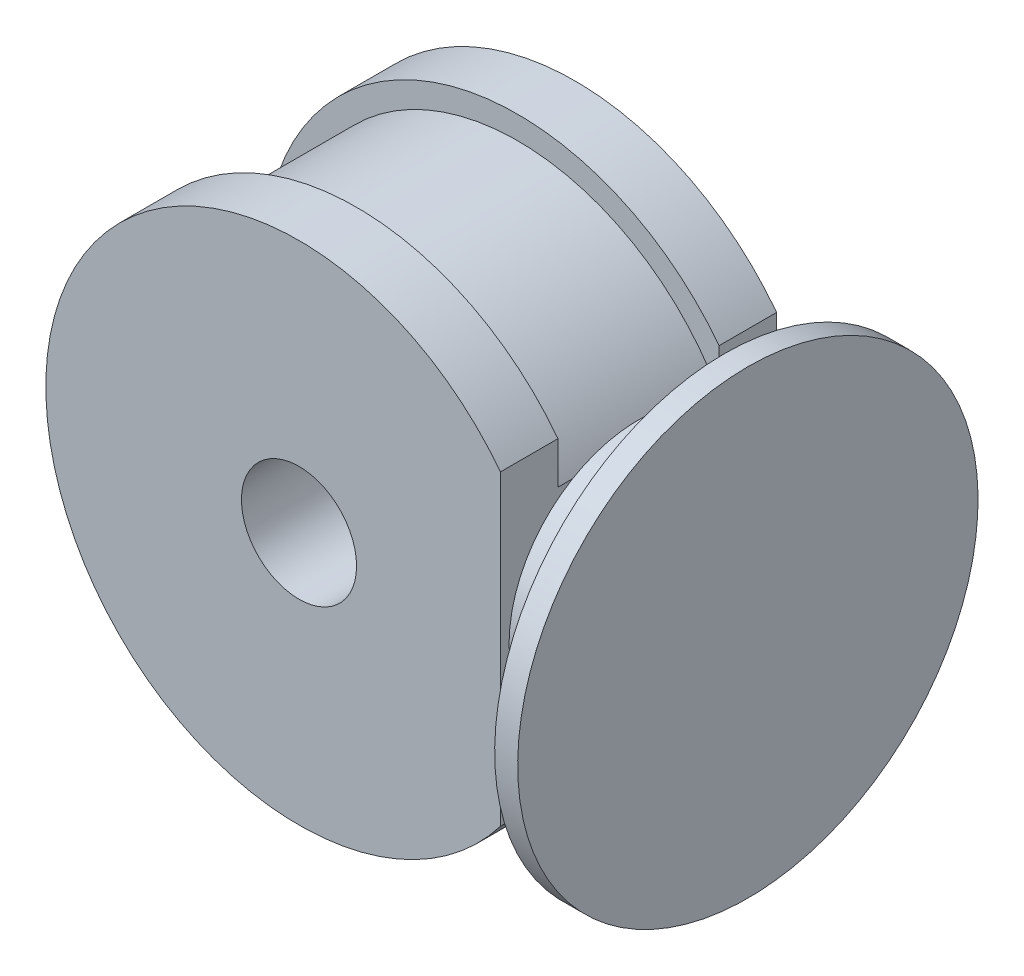
from build123d import *

# Parameters (mm, degrees)
ESQUISSE1_R             = 44
BOSS_EXTRU_1_DEPTH      = 10
ESQUISSE2_R             = 40
BOSS_EXTRU_2_DEPTH      = 28
ESQUISSE3_R             = 44
BOSS_EXTRU_3_DEPTH      = 10
ESQUISSE5_W             = 32.472445712
ESQUISSE5_H             = 94.731646138
ENL_V_MAT_EXTRU_2_DEPTH = 79.587530818
ESQUISSE4_R             = 10
ENL_V_MAT_EXTRU_1_DEPTH = 79.587530818
SKETCH1_R               = 22.5
BOSS_EXTRUDE1_DEPTH     = 15
SKETCH2_R               = 40
BOSS_EXTRUDE2_DEPTH     = 4


with BuildPart() as part:
    # Esquisse1 → Boss.-Extru.1 (new body)
    with BuildSketch(Plane.XY):
        Circle(ESQUISSE1_R)
    extrude(amount=BOSS_EXTRU_1_DEPTH)

    # Esquisse2 → Boss.-Extru.2 (add)
    with BuildSketch(Plane.XY.offset(10)):
        Circle(ESQUISSE2_R)
    extrude(amount=BOSS_EXTRU_2_DEPTH)

    # Esquisse3 → Boss.-Extru.3 (add)
    with BuildSketch(Plane.XY.offset(38)):
        Circle(ESQUISSE3_R)
    extrude(amount=BOSS_EXTRU_3_DEPTH)

    # Esquisse5 → Enlèv. mat.-Extru.2 (cut, through all)
    with BuildSketch(Plane.XY.offset(48)):
        with Locations((51.236222856, -3.296075317)):
            Rectangle(ESQUISSE5_W, ESQUISSE5_H)
    extrude(amount=-ENL_V_MAT_EXTRU_2_DEPTH, mode=Mode.SUBTRACT)

    # Esquisse4 → Enlèv. mat.-Extru.1 (cut, through all)
    with BuildSketch(Plane.XY.offset(48)):
        Circle(ESQUISSE4_R)
    extrude(amount=-ENL_V_MAT_EXTRU_1_DEPTH, mode=Mode.SUBTRACT)

    # Sketch1 → Boss-Extrude1 (add)
    with BuildSketch(Plane(origin=(35, 0, 0), x_dir=(0, 0, -1), z_dir=(1, 0, 0))):
        with Locations(Location((-24, 0, 0), (0, 0, 239.39110234))):
            Circle(SKETCH1_R)
    extrude(amount=BOSS_EXTRUDE1_DEPTH)

    # Sketch2 → Boss-Extrude2 (add)
    with BuildSketch(Plane(origin=(50, 0, 0), x_dir=(0, 0, -1), z_dir=(1, 0, 0))):
        with Locations(Location((-24, 0, 0), (0, 0, 90))):
            Circle(SKETCH2_R)
    extrude(amount=BOSS_EXTRUDE2_DEPTH)


solid = part.part
